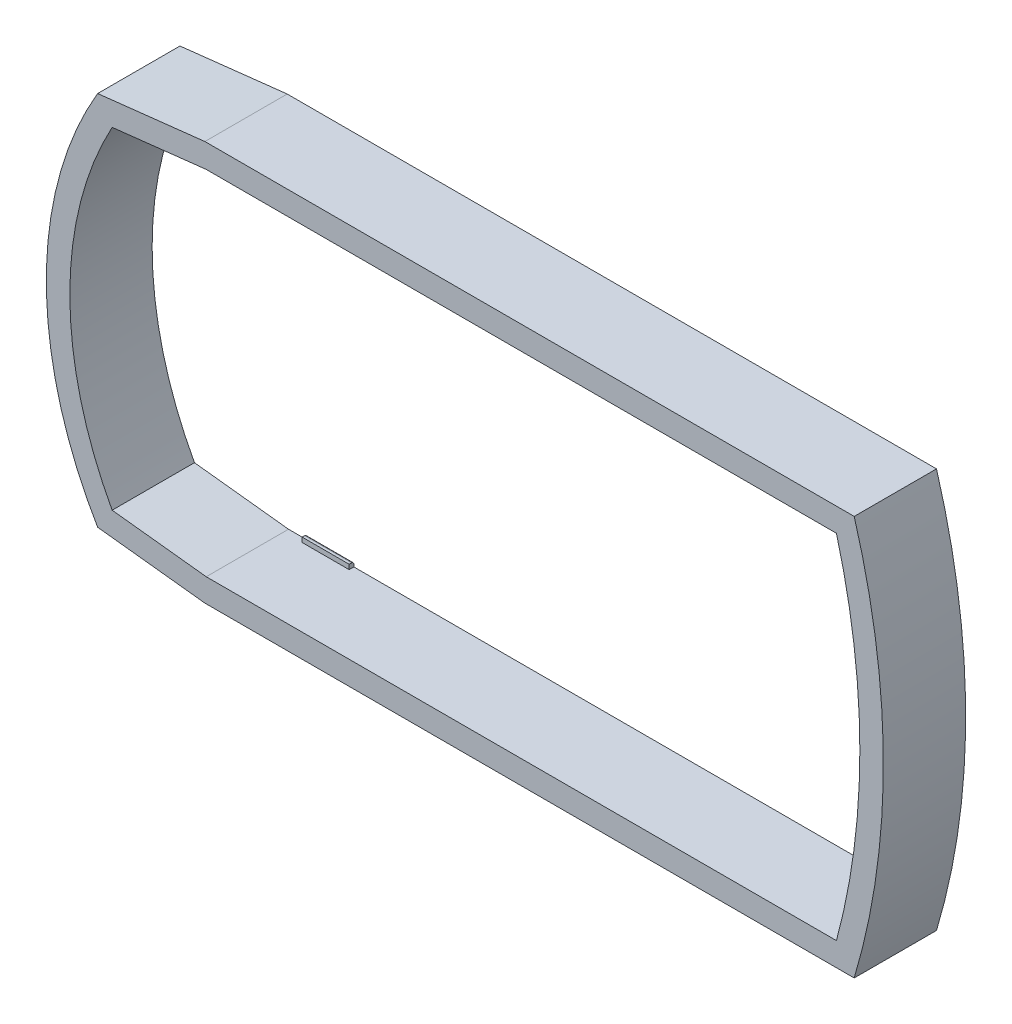
from build123d import *

# Parameters (mm, degrees)
EXTRU_MINCE1_DEPTH = 35
ESQUISSE1_13_W     = 3
ESQUISSE1_13_H     = 25
BOSS_EXTRU_1_DEPTH = 2
ESQUISSE1_14_W     = 20
ESQUISSE1_14_H     = 2
BOSS_EXTRU_2_DEPTH = 2
ESQUISSE1_15_W     = 20
ESQUISSE1_15_H     = 2
BOSS_EXTRU_3_DEPTH = 2
CONG_2_R           = 1
CONG_3_R           = 1
CONG_4_R           = 0.5


with BuildPart() as part:
    # Esquisse1 → Extru.-Mince1 (new body)
    with BuildSketch(Plane.XY):
        with BuildLine():
            Line((-198.953146912, 52.713133275), (-153.336718001, 57.844981528))
            Line((-153.336718001, 57.844981528), (122.776592962, 57.844981528))
            ThreePointArc((122.776592962, 57.844981528), (135.183889941, -27.155018472), (122.776592962, -112.155018472))
            Line((122.776592962, -112.155018472), (-153.336718001, -112.155018472))
            Line((-153.336718001, -112.155018472), (-198.953146912, -107.02317022))
            ThreePointArc((-198.953146912, -107.02317022), (-220.774609776, -27.155018472), (-198.953146912, 52.713133275))
        make_face()
        with BuildLine():
            Line((-192.775986612, 43.344981528), (-152.775986612, 47.844981528))
            Line((-152.775986612, 47.844981528), (115.224013388, 47.844981528))
            ThreePointArc((115.224013388, 47.844981528), (125.183889941, -27.155018472), (115.224013388, -102.155018472))
            Line((115.224013388, -102.155018472), (-152.775986612, -102.155018472))
            Line((-152.775986612, -102.155018472), (-192.775986612, -97.655018472))
            ThreePointArc((-192.775986612, -97.655018472), (-210.774609776, -27.155018472), (-192.775986612, 43.344981528))
        make_face(mode=Mode.SUBTRACT)
    extrude(amount=EXTRU_MINCE1_DEPTH)

    # Esquisse1<14> → Boss.-Extru.2 (add)
    with BuildSketch(Plane.XY):
        with Locations((-134.987389646, -101.155018472)):
            Rectangle(ESQUISSE1_14_W, ESQUISSE1_14_H)
    extrude(amount=BOSS_EXTRU_2_DEPTH)

    # Esquisse1<15> → Boss.-Extru.3 (add)
    with BuildSketch(Plane.XY):
        with Locations((-134.987389646, 46.844981528)):
            Rectangle(ESQUISSE1_15_W, ESQUISSE1_15_H)
    extrude(amount=BOSS_EXTRU_3_DEPTH)

    # Congé2
    cong_2_edges = [part.edges().sort_by_distance(p)[0] for p in [
        (-134.987389646, 45.844981528, 0),
    ]]
    fillet(cong_2_edges, radius=CONG_2_R)

    # Congé3
    cong_3_edges = [part.edges().sort_by_distance(p)[0] for p in [
        (-134.987389646, -100.155018472, 0),
    ]]
    fillet(cong_3_edges, radius=CONG_3_R)


with BuildPart() as body_2:
    # Esquisse1<13> → Boss.-Extru.1 (new body)
    with BuildSketch(Plane.XY):
        with Locations((123.411892491, -27.155018472)):
            Rectangle(ESQUISSE1_13_W, ESQUISSE1_13_H)
    extrude(amount=BOSS_EXTRU_1_DEPTH)

    # Congé4
    cong_4_edges = [body_2.edges().sort_by_distance(p)[0] for p in [
        (121.911892491, -27.155018472, 0),
    ]]
    fillet(cong_4_edges, radius=CONG_4_R)


solid = Compound([part.part, body_2.part])
